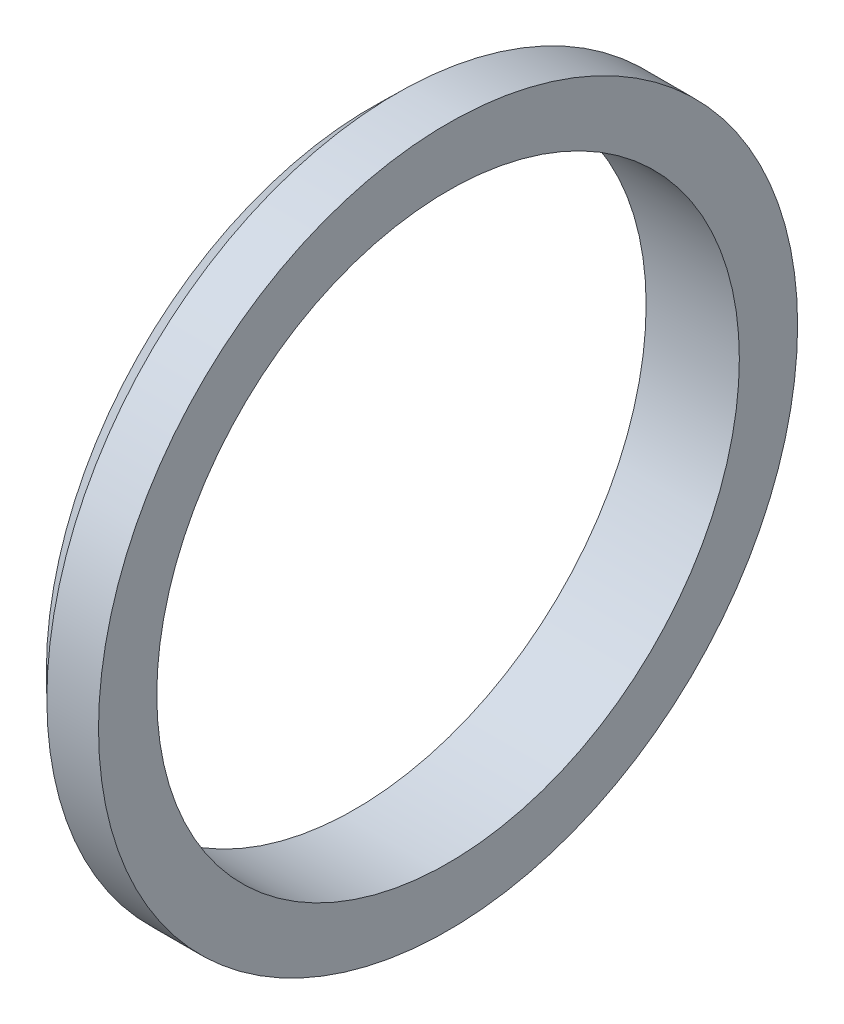
from build123d import *


with BuildPart() as part:
    # Sketch1 → Revolve1 (revolve)
    with BuildSketch(Plane.XY, mode=Mode.PRIVATE) as revolve1_sk:
        Polygon((-0.074345152, 12.5), (3.925654848, 12.5), (3.925654848, 15), (1.708455461, 15), (0.633473344, 13.944369823), (0.633473344, 13.132209385), (0.213761608, 13.132209385), (-0.074345152, 12.816104693), align=None)
    revolve(revolve1_sk.sketch.rotate(Axis((0, 0, 0), (1, 0, 0)), 90), axis=Axis((0, 0, 0), (1, 0, 0)))


solid = part.part
